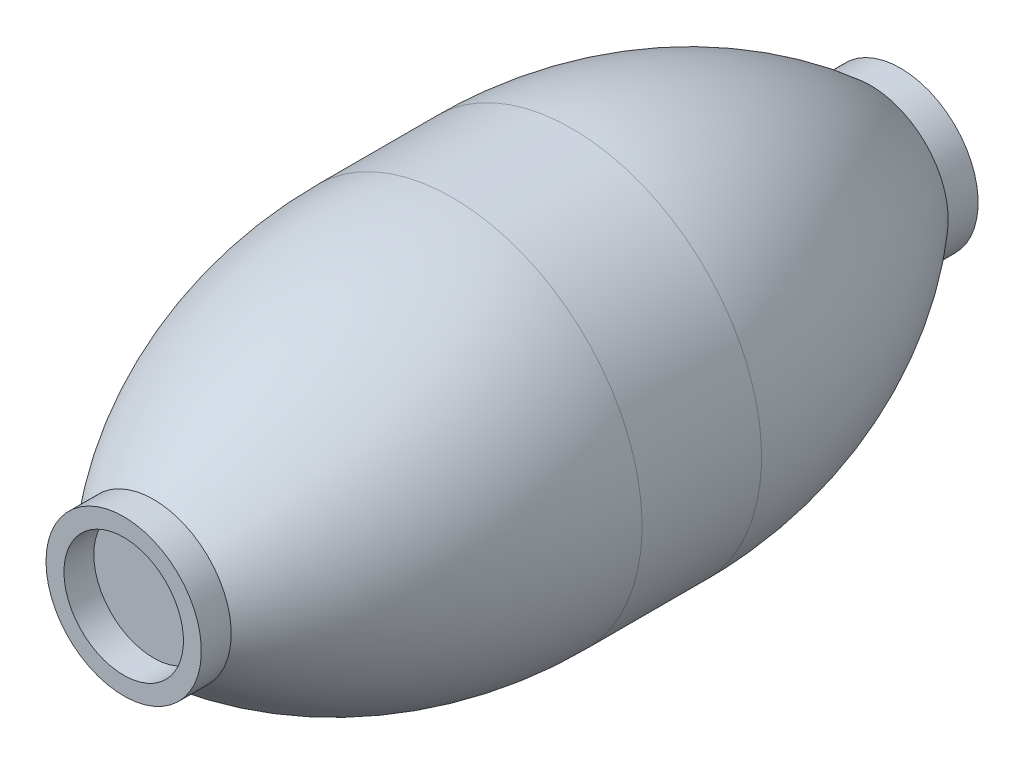
from build123d import *


with BuildPart() as part:
    # Sketch2 → Revolve1 (revolve)
    with BuildSketch(Plane(origin=(0, 0, 0), x_dir=(1, 0, 0), z_dir=(0, 1, 0))):
        with BuildLine():
            Line((-20, 130), (-20, 120))
            Line((-20, 120), (0, 120))
            Line((0, 120), (0, -120))
            Line((0, -120), (-20, -120))
            Line((-20, -120), (-20, -130))
            Line((-20, -130), (-26, -130))
            Line((-26, -130), (-26, -120))
            ThreePointArc((-26, -120), (-53.816729089, -73.400023408), (-63.5, -20))
            Line((-63.5, -20), (-63.5, 20))
            ThreePointArc((-63.5, 20), (-53.816729089, 73.400023408), (-26, 120))
            Line((-26, 120), (-26, 130))
            Line((-26, 130), (-20, 130))
        make_face()
    revolve(axis=Axis((0, 0, -130), (0, 0, 1)))


solid = part.part
